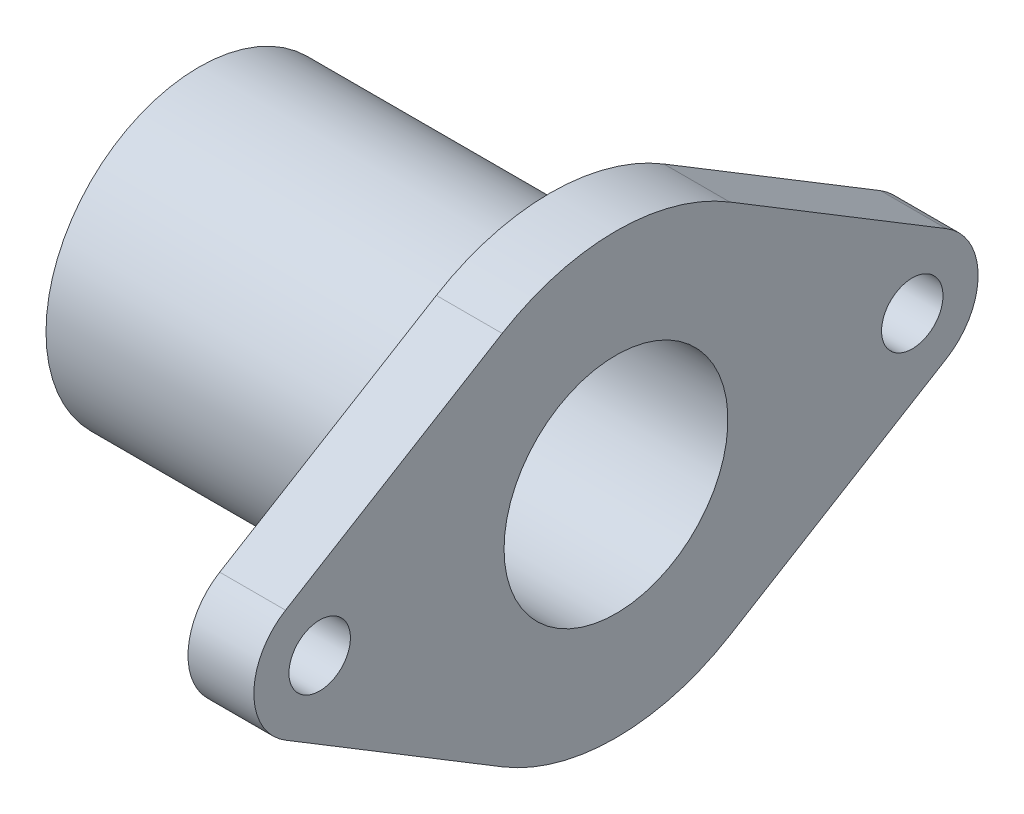
from build123d import *

# Parameters (mm, degrees)
BOSS_EXTRUDE1_DEPTH = 15
SKETCH2_R           = 7
CUT_EXTRUDE1_DEPTH  = 98.628120949
SKETCH3_R           = 25.5
CUT_EXTRUDE2_DEPTH  = 98.628120949
BOSS_EXTRUDE2_START = 80
SKETCH4_R           = 34.85
SKETCH4_R_2         = 25.5
BOSS_EXTRUDE2_DEPTH = 80


with BuildPart() as part:
    # Sketch1 → Boss-Extrude1 (new body)
    with BuildSketch(Plane(origin=(0, 0, 0), x_dir=(0, 0, -1), z_dir=(1, 0, 0))):
        with BuildLine():
            Line((-25.925925926, 42.753319928), (-75.277777778, 12.825995978))
            ThreePointArc((-75.277777778, 12.825995978), (-82.5, 0), (-75.277777778, -12.825995978))
            Line((-75.277777778, -12.825995978), (-25.925925926, -42.753319928))
            ThreePointArc((-25.925925926, -42.753319928), (0, -50), (25.925925926, -42.753319928))
            Line((25.925925926, -42.753319928), (75.277777778, -12.825995978))
            ThreePointArc((75.277777778, -12.825995978), (82.5, 0), (75.277777778, 12.825995978))
            Line((75.277777778, 12.825995978), (25.925925926, 42.753319928))
            ThreePointArc((25.925925926, 42.753319928), (0, 50), (-25.925925926, 42.753319928))
        make_face()
    extrude(amount=BOSS_EXTRUDE1_DEPTH)

    # Sketch2 → Cut-Extrude1 (cut, through all)
    with BuildSketch(Plane.ZY):
        with Locations((67.5, 0)):
            Circle(SKETCH2_R)
        with Locations((-67.5, 0)):
            Circle(SKETCH2_R)
    extrude(amount=-CUT_EXTRUDE1_DEPTH, mode=Mode.SUBTRACT)

    # Sketch3 → Cut-Extrude2 (cut, through all)
    with BuildSketch(Plane.ZY):
        Circle(SKETCH3_R)
    extrude(amount=-CUT_EXTRUDE2_DEPTH, mode=Mode.SUBTRACT)

    # Sketch4 → Boss-Extrude2 (add)
    with BuildSketch(Plane.ZY.offset(BOSS_EXTRUDE2_START)):
        with Locations(Location((0, 0, 0), (0, 0, 180))):
            Circle(SKETCH4_R)
        Circle(SKETCH4_R_2, mode=Mode.SUBTRACT)
    extrude(amount=-BOSS_EXTRUDE2_DEPTH)

    # Sketch5 → Revolve1 (revolve)
    with BuildSketch(Plane(origin=(0, 0, 0), x_dir=(1, 0, 0), z_dir=(0, 1, 0))):
        Polygon((0, 34.85), (-5, 34.85), (0, 41.85), align=None)
    revolve(axis=Axis((0, 0, 0), (-1, 0, 0)))


solid = part.part
